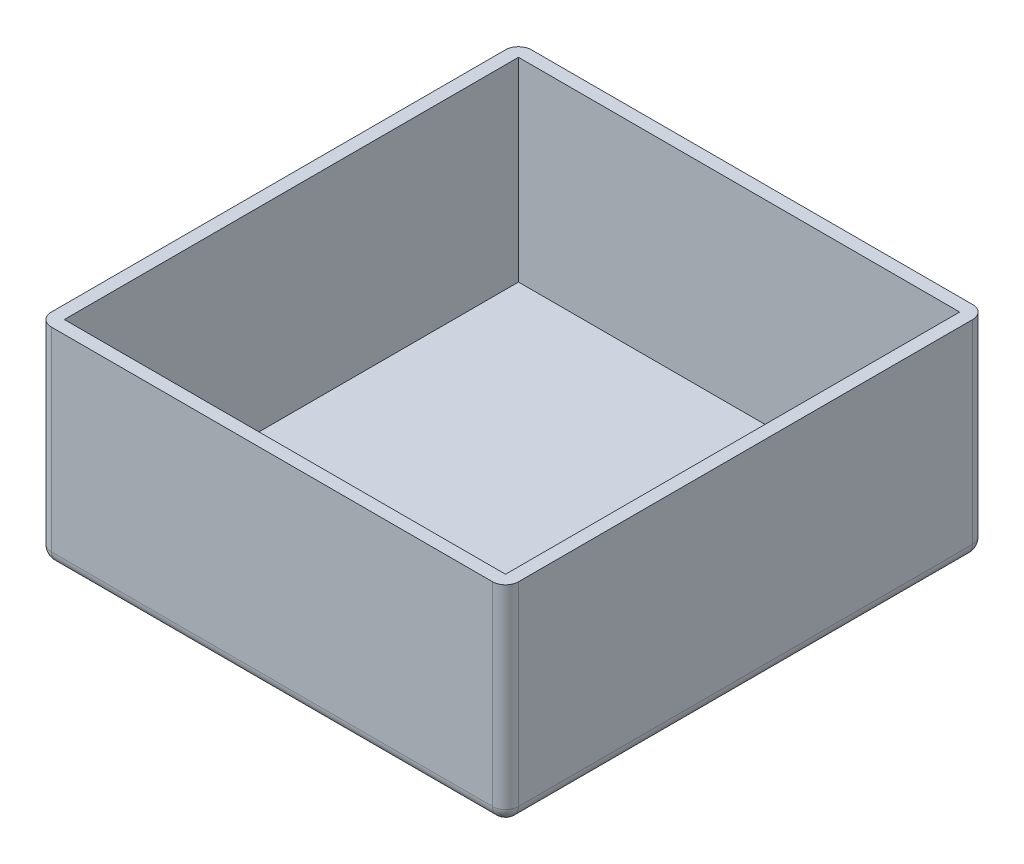
from build123d import *

# Parameters (mm, degrees)
SKETCH_1_W          = 36
SKETCH_1_H          = 37
EXTRUDE_2_DEPTH     = 16
SKETCH_2_W          = 34
SKETCH_2_H          = 35
CUT_EXTRUDE_1_DEPTH = 15
FILLET_1_R          = 1


with BuildPart() as part:
    # ｽｹｯﾁ1 → ﾎﾞｽ - 押し出し2 (new body)
    with BuildSketch(Plane(origin=(0, 0, 0), x_dir=(1, 0, 0), z_dir=(0, 1, 0))):
        with Locations((-2.682211452, 11.454993769)):
            Rectangle(SKETCH_1_W, SKETCH_1_H)
    extrude(amount=EXTRUDE_2_DEPTH)

    # ｽｹｯﾁ2 → ｶｯﾄ - 押し出し1 (cut)
    with BuildSketch(Plane(origin=(0, 16, 0), x_dir=(1, 0, 0), z_dir=(0, 1, 0))):
        with Locations((-2.682211452, 11.454993769)):
            Rectangle(SKETCH_2_W, SKETCH_2_H)
    extrude(amount=-CUT_EXTRUDE_1_DEPTH, mode=Mode.SUBTRACT)

    # ﾌｨﾚｯﾄ1
    fillet_1_edges = [part.edges().sort_by_distance(p)[0] for p in [
        (-2.682211452, 0, -29.954993769),
        (15.317788548, 0, -11.454993769),
        (-2.682211452, 0, 7.045006231),
        (-20.682211452, 0, -11.454993769),
        (-20.682211452, 8, -29.954993769),
        (15.317788548, 8, -29.954993769),
        (15.317788548, 8, 7.045006231),
        (-20.682211452, 8, 7.045006231),
    ]]
    fillet(fillet_1_edges, radius=FILLET_1_R)


solid = part.part
